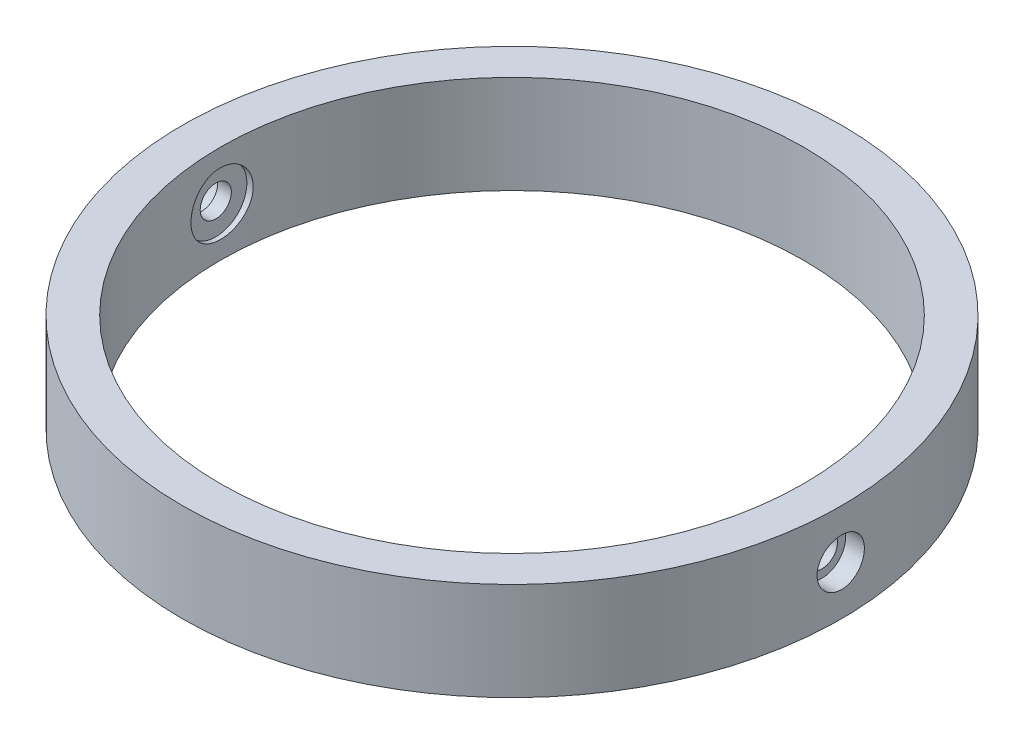
from build123d import *

# Parameters (mm, degrees)
SKETCH1_R           = 67.25
SKETCH1_R_2         = 59.5
BOSS_EXTRUDE1_DEPTH = 20
SKETCH4_R           = 3.175
CUT_EXTRUDE2_DEPTH  = 200
SKETCH5_R           = 4.826
CUT_EXTRUDE3_DEPTH  = 4
SKETCH6_R           = 6.35
CUT_EXTRUDE4_DEPTH  = 1


with BuildPart() as part:
    # Sketch1 → Boss-Extrude1 (new body)
    with BuildSketch(Plane(origin=(0, 0, 0), x_dir=(1, 0, 0), z_dir=(0, 1, 0))):
        Circle(SKETCH1_R)
        Circle(SKETCH1_R_2, mode=Mode.SUBTRACT)
    extrude(amount=BOSS_EXTRUDE1_DEPTH)

    # Sketch4 → Cut-Extrude2 (cut)
    with BuildSketch(Plane(origin=(67.25, 0, 0), x_dir=(0, 0, -1), z_dir=(1, 0, 0))):
        with Locations((0, 10)):
            Circle(SKETCH4_R)
    extrude(amount=-CUT_EXTRUDE2_DEPTH, mode=Mode.SUBTRACT)

    # Sketch5 → Cut-Extrude3 (cut)
    with BuildSketch(Plane(origin=(67.25, 0, 0), x_dir=(0, 0, -1), z_dir=(1, 0, 0))):
        with Locations((0, 10)):
            Circle(SKETCH5_R)
    cut_extrude3 = extrude(amount=-CUT_EXTRUDE3_DEPTH, mode=Mode.SUBTRACT)

    # Mirror1: Cut-Extrude3 across plane
    add(cut_extrude3.mirror(Plane(origin=(0, 0, 0), x_dir=(0, 0, 1), z_dir=(1, 0, 0))), mode=Mode.SUBTRACT)

    # Sketch6 → Cut-Extrude4 (cut, symmetric)
    with BuildSketch(Plane(origin=(59.45, 0, 0), x_dir=(0, 0, -1), z_dir=(1, 0, 0))):
        with Locations((0, 10)):
            Circle(SKETCH6_R)
    cut_extrude4 = extrude(amount=CUT_EXTRUDE4_DEPTH, both=True, mode=Mode.SUBTRACT)

    # Mirror2: Cut-Extrude4 across plane
    add(cut_extrude4.mirror(Plane(origin=(0, 0, 0), x_dir=(0, 0, 1), z_dir=(1, 0, 0))), mode=Mode.SUBTRACT)


solid = part.part
